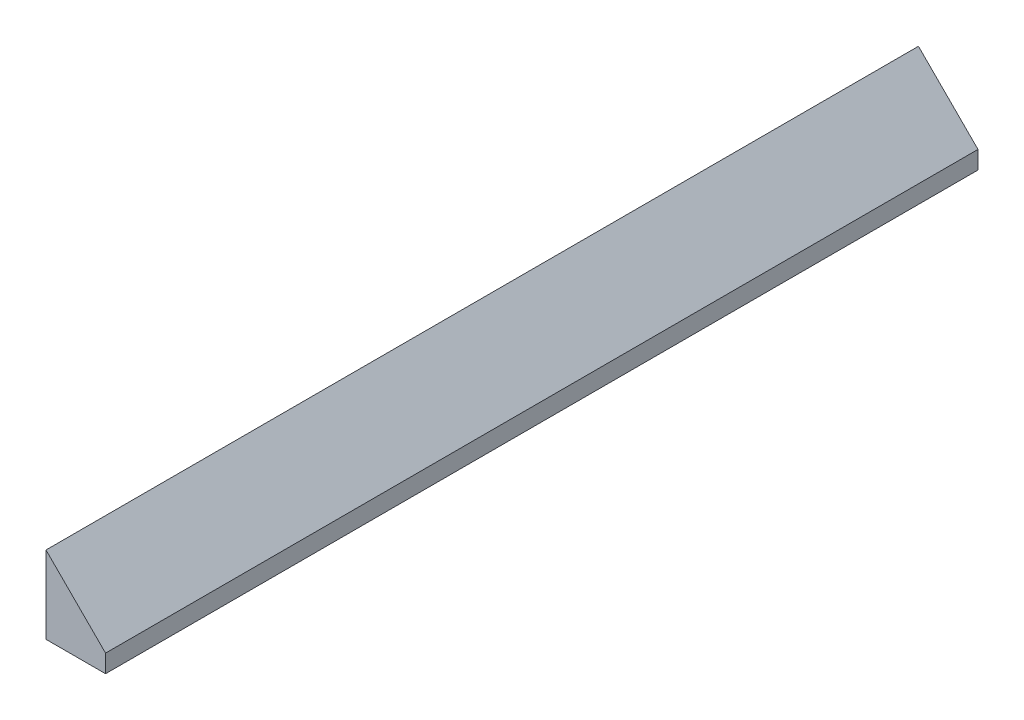
from build123d import *

# Parameters (mm, degrees)
BOSS_EXTRUDE1_DEPTH = 14.65


with BuildPart() as part:
    # Sketch1 → Boss-Extrude1 (new, symmetric)
    with BuildSketch(Plane.XY):
        Polygon((0, 2.6), (0, 0), (2, 0), (2, 0.6), align=None)
    extrude(amount=BOSS_EXTRUDE1_DEPTH, both=True)


solid = part.part
